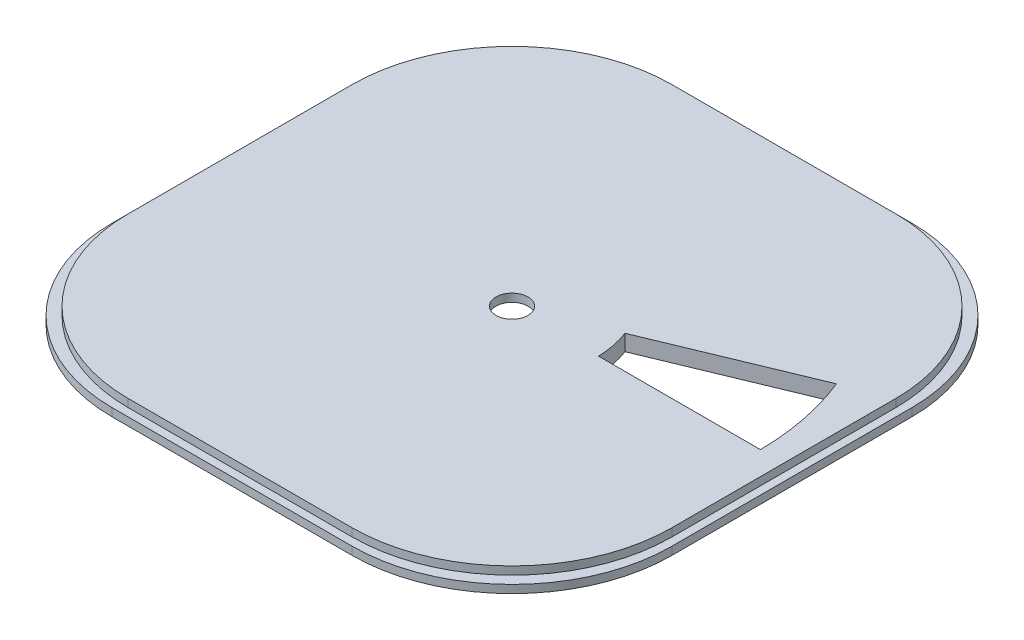
from build123d import *

# Parameters (mm, degrees)
BOSS_EXTRUDE5_DEPTH     = 2
BOSS_EXTRUDE6_DEPTH     = 2
SKETCH6_R               = 11
CUT_EXTRUDE1_DEPTH      = 2
CUT_EXTRUDE3_DEPTH      = 24
CUT_EXTRUDE3_DEPTH_BACK = 35
SKETCH7_R               = 2.603714659
SKETCH8_R               = 1.4
BOSS_EXTRUDE8_DEPTH     = 4
CUT_EXTRUDE8_DEPTH      = 4
CUT_EXTRUDE9_START      = -2
SKETCH17_R              = 1.4
CUT_EXTRUDE9_DEPTH      = 2
CUT_EXTRUDE10_DEPTH     = 1
SKETCH19_R              = 4
CUT_EXTRUDE11_DEPTH     = 10


with BuildPart() as part:
    # Sketch1 → Boss-Extrude5 (new body)
    with BuildSketch(Plane(origin=(0, 0, 0), x_dir=(1, 0, 0), z_dir=(0, 1, 0))):
        with BuildLine():
            Line((-30, 70), (30, 70))
            ThreePointArc((30, 70), (58.284271247, 58.284271247), (70, 30))
            Line((70, 30), (70, -30))
            ThreePointArc((70, -30), (58.284271247, -58.284271247), (30, -70))
            Line((30, -70), (-30, -70))
            ThreePointArc((-30, -70), (-58.284271247, -58.284271247), (-70, -30))
            Line((-70, -30), (-70, 30))
            ThreePointArc((-70, 30), (-58.284271247, 58.284271247), (-30, 70))
        make_face()
    extrude(amount=-BOSS_EXTRUDE5_DEPTH)

    # Sketch5 → Boss-Extrude6 (add)
    with BuildSketch(Plane(origin=(0, 0, 0), x_dir=(1, 0, 0), z_dir=(0, 1, 0))):
        with BuildLine():
            Line((-28, 68), (28, 68))
            ThreePointArc((28, 68), (56.284271247, 56.284271247), (68, 28))
            Line((68, 28), (68, -28))
            ThreePointArc((68, -28), (56.284271247, -56.284271247), (28, -68))
            Line((28, -68), (-28, -68))
            ThreePointArc((-28, -68), (-56.284271247, -56.284271247), (-68, -28))
            Line((-68, -28), (-68, 28))
            ThreePointArc((-68, 28), (-56.284271247, 56.284271247), (-28, 68))
        make_face()
    extrude(amount=BOSS_EXTRUDE6_DEPTH)

    # Sketch6 → Cut-Extrude1 (cut)
    with BuildSketch(Plane.XZ.offset(2)):
        with Locations(Location((0, 0, 0), (0, 0, 270))):
            Circle(SKETCH6_R)
    extrude(amount=-CUT_EXTRUDE1_DEPTH, mode=Mode.SUBTRACT)

    # Sketch7 → Cut-Extrude3 (cut, two sides: drawn at the far end of the back side and taken through both)
    with BuildSketch(Plane.XZ.offset(-CUT_EXTRUDE3_DEPTH_BACK)):
        with Locations(Location((0, 0, 0), (0, 0, 90))):
            Circle(SKETCH7_R)
    extrude(amount=CUT_EXTRUDE3_DEPTH + CUT_EXTRUDE3_DEPTH_BACK, mode=Mode.SUBTRACT)

    # Sketch8 → Boss-Extrude8 (add)
    with BuildSketch(Plane(origin=(0, 0, 0), x_dir=(1, 0, 0), z_dir=(0, 1, 0))):
        with Locations(Location((13, 13, 0), (0, 0, 270))):
            Circle(SKETCH8_R)
        with Locations(Location((13, -13, 0), (0, 0, 270))):
            Circle(SKETCH8_R)
        with Locations(Location((-13, -13, 0), (0, 0, 270))):
            Circle(SKETCH8_R)
        with Locations(Location((-13, 13, 0), (0, 0, 270))):
            Circle(SKETCH8_R)
    extrude(amount=-BOSS_EXTRUDE8_DEPTH)

    # Sketch15 → Cut-Extrude8 (cut)
    with BuildSketch(Plane(origin=(0, 2, 0), x_dir=(1, 0, 0), z_dir=(0, 1, 0))):
        with BuildLine():
            Line((20.002895237, 8.260924079), (57.425217049, 23.761757309))
            ThreePointArc((57.425217049, 23.761757309), (60.897596895, 12.098982138), (62.152687059, -0.004839374))
            Line((62.152687059, -0.004839374), (21.647057814, -0.004839374))
            ThreePointArc((21.647057814, -0.004839374), (21.175793038, 4.197824096), (20.002895237, 8.260924079))
        make_face()
    extrude(amount=-CUT_EXTRUDE8_DEPTH, mode=Mode.SUBTRACT)

    # Sketch17 → Cut-Extrude9 (cut)
    with BuildSketch(Plane.XZ.offset(4).offset(CUT_EXTRUDE9_START)):
        with Locations((13, 13)):
            Circle(SKETCH17_R)
        with Locations((13, -13)):
            Circle(SKETCH17_R)
        with Locations((-13, -13)):
            Circle(SKETCH17_R)
        with Locations((-13, 13)):
            Circle(SKETCH17_R)
    extrude(amount=CUT_EXTRUDE9_DEPTH, mode=Mode.SUBTRACT)

    # Sketch18 → Cut-Extrude10 (cut)
    with BuildSketch(Plane.XZ.offset(2)):
        with BuildLine():
            Line((-70, 0), (-70, 4))
            Line((-70, 4), (-10.246950766, 4))
            ThreePointArc((-10.246950766, 4), (-11, 0), (-10.246950766, -4))
            Line((-10.246950766, -4), (-70, -4))
            Line((-70, -4), (-70, 0))
        make_face()
    extrude(amount=-CUT_EXTRUDE10_DEPTH, mode=Mode.SUBTRACT)

    # Sketch19 → Cut-Extrude11 (cut)
    with BuildSketch(Plane.XZ):
        with Locations(Location((0, 0, 0), (0, 0, 270))):
            Circle(SKETCH19_R)
    extrude(amount=-CUT_EXTRUDE11_DEPTH, mode=Mode.SUBTRACT)


solid = part.part
